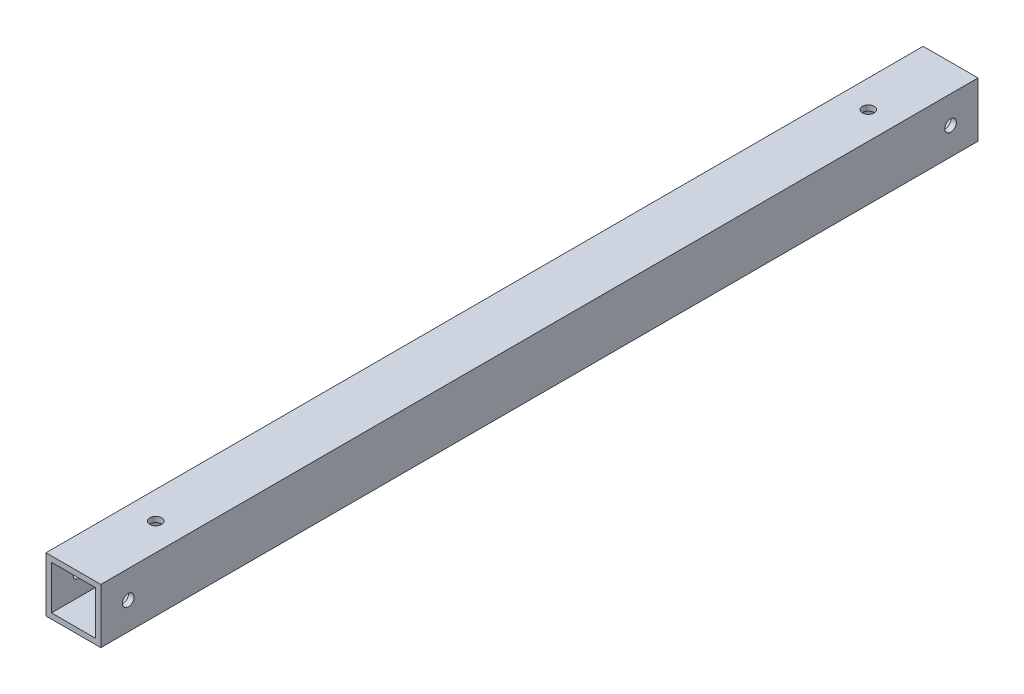
from build123d import *

# Parameters (mm, degrees)
SKETCH_1_W          = 15
SKETCH_1_H          = 15
SKETCH_1_W_2        = 12
SKETCH_1_H_2        = 12
EXTRUDE_1_DEPTH     = 240
SKETCH_2_R          = 1.6
CUT_EXTRUDE_1_DEPTH = 241.585223985
SKETCH_3_R          = 1.6
CUT_EXTRUDE_2_DEPTH = 241.585223985


with BuildPart() as part:
    # ｽｹｯﾁ1 → ﾎﾞｽ - 押し出し1 (new body)
    with BuildSketch(Plane.XY):
        Rectangle(SKETCH_1_W, SKETCH_1_H)
        Rectangle(SKETCH_1_W_2, SKETCH_1_H_2, mode=Mode.SUBTRACT)
    extrude(amount=EXTRUDE_1_DEPTH)

    # ｽｹｯﾁ2 → ｶｯﾄ - 押し出し1 (cut, through all)
    with BuildSketch(Plane(origin=(0, 7.5, 0), x_dir=(1, 0, 0), z_dir=(0, 1, 0))):
        with Locations(Location((0, -22.5, 0), (0, 0, 270))):
            Circle(SKETCH_2_R)
        with Locations(Location((0, -217.5, 0), (0, 0, 270))):
            Circle(SKETCH_2_R)
    extrude(amount=-CUT_EXTRUDE_1_DEPTH, mode=Mode.SUBTRACT)

    # ｽｹｯﾁ3 → ｶｯﾄ - 押し出し2 (cut, through all)
    with BuildSketch(Plane(origin=(7.5, 0, 0), x_dir=(0, 0, -1), z_dir=(1, 0, 0))):
        with Locations((-232.5, 0)):
            Circle(SKETCH_3_R)
        with Locations((-7.5, 0)):
            Circle(SKETCH_3_R)
    extrude(amount=-CUT_EXTRUDE_2_DEPTH, mode=Mode.SUBTRACT)


solid = part.part
